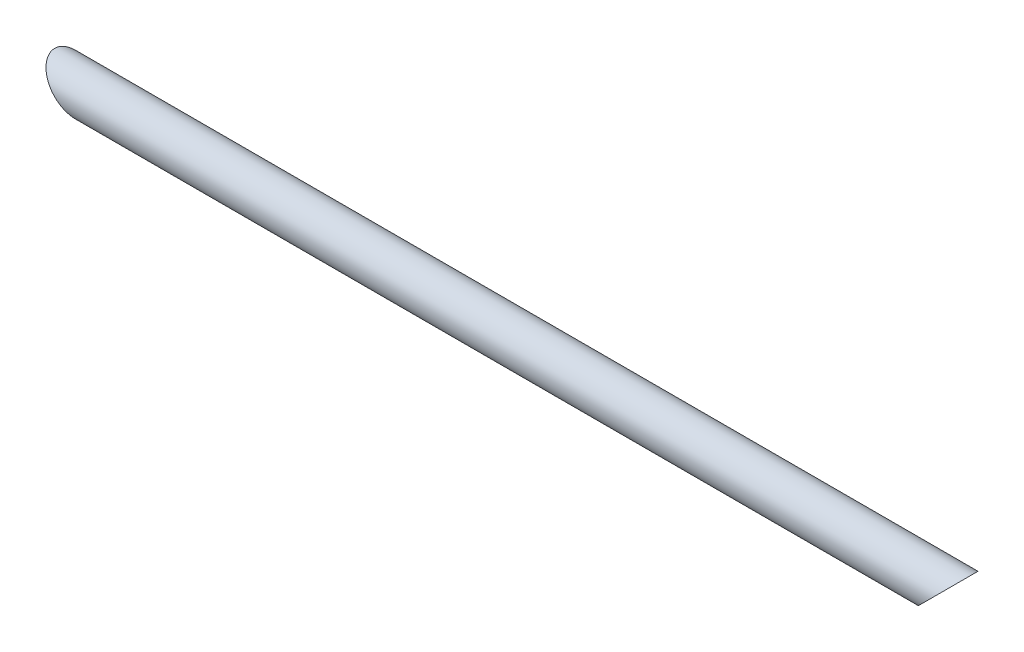
from build123d import *

# Parameters (mm, degrees)
SKETCH1_R           = 12.7
SKETCH1_R_2         = 11.7
EXTRUDE_THIN1_DEPTH = 275.4


with BuildPart() as part:
    # Sketch1 → Extrude-Thin1 (new, symmetric)
    with BuildSketch(Plane(origin=(0, 0, 0), x_dir=(0, 0, -1), z_dir=(1, 0, 0))):
        Circle(SKETCH1_R)
        Circle(SKETCH1_R_2, mode=Mode.SUBTRACT)
    extrude(amount=EXTRUDE_THIN1_DEPTH, both=True)

    # SurfaceCut1
    split(bisect_by=Plane(origin=(131.35, -131.35, 0), x_dir=(-0.7071067811865472, -0.7071067811865478, 0), z_dir=(-0.7071067811865478, 0.7071067811865472, 0)), keep=Keep.TOP)

    # SurfaceCut2
    split(bisect_by=Plane(origin=(-131.35, -131.35, 0), x_dir=(0.7071067811865515, -0.7071067811865436, 0), z_dir=(-0.7071067811865436, -0.7071067811865515, 0)), keep=Keep.BOTTOM)


solid = part.part
